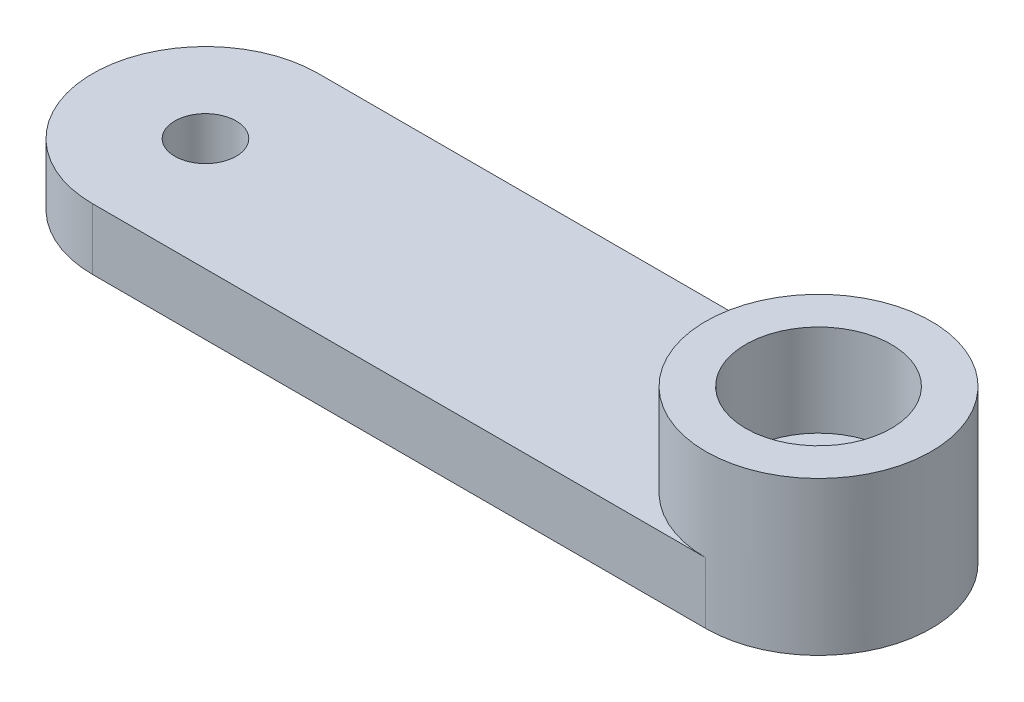
from build123d import *

# Parameters (mm, degrees)
SKETCH1_R           = 3.68
BOSS_EXTRUDE1_DEPTH = 2
BOSS_EXTRUDE2_START = 3
SKETCH2_R           = 3.68
SKETCH2_R_2         = 2.375
BOSS_EXTRUDE2_DEPTH = 3
BOSS_EXTRUDE3_START = -2
BOSS_EXTRUDE3_DEPTH = 2
SKETCH7_R           = 1
CUT_EXTRUDE4_DEPTH  = 2
SKETCH8_R           = 2
CUT_EXTRUDE6_DEPTH  = 1.5


with BuildPart() as part:
    # Sketch1 → Boss-Extrude1 (new body)
    with BuildSketch(Plane(origin=(0, 0, 0), x_dir=(1, 0, 0), z_dir=(0, 1, 0))):
        with Locations(Location((0, 0, 0), (0, 0, 270))):
            Circle(SKETCH1_R)
    extrude(amount=-BOSS_EXTRUDE1_DEPTH)

    # Sketch2 → Boss-Extrude2 (add)
    with BuildSketch(Plane(origin=(0, 0, 0), x_dir=(1, 0, 0), z_dir=(0, 1, 0)).offset(BOSS_EXTRUDE2_START)):
        with Locations(Location((0, 0, 0), (0, 0, 270))):
            Circle(SKETCH2_R)
        with Locations(Location((0, 0, 0), (0, 0, 270))):
            Circle(SKETCH2_R_2, mode=Mode.SUBTRACT)
    extrude(amount=-BOSS_EXTRUDE2_DEPTH)

    # Sketch6 → Boss-Extrude3 (add)
    with BuildSketch(Plane.XZ.offset(2).offset(BOSS_EXTRUDE3_START)):
        with BuildLine():
            Line((0, -3.68), (-20, -3.68))
            ThreePointArc((-20, -3.68), (-23.68, 0), (-20, 3.68))
            Line((-20, 3.68), (0, 3.68))
            ThreePointArc((0, 3.68), (3.68, 0), (0, -3.68))
        make_face()
    extrude(amount=BOSS_EXTRUDE3_DEPTH)

    # Sketch7 → Cut-Extrude4 (cut)
    with BuildSketch(Plane.XZ.offset(2)):
        with Locations(Location((0, 0, 0), (0, 0, 270))):
            Circle(SKETCH7_R)
        with Locations(Location((-20, 0, 0), (0, 0, 270))):
            Circle(SKETCH7_R)
    extrude(amount=-CUT_EXTRUDE4_DEPTH, mode=Mode.SUBTRACT)

    # Sketch8 → Cut-Extrude6 (cut)
    with BuildSketch(Plane.XZ.offset(2)):
        with Locations(Location((0, 0, 0), (0, 0, 270))):
            Circle(SKETCH8_R)
    extrude(amount=-CUT_EXTRUDE6_DEPTH, mode=Mode.SUBTRACT)


solid = part.part
